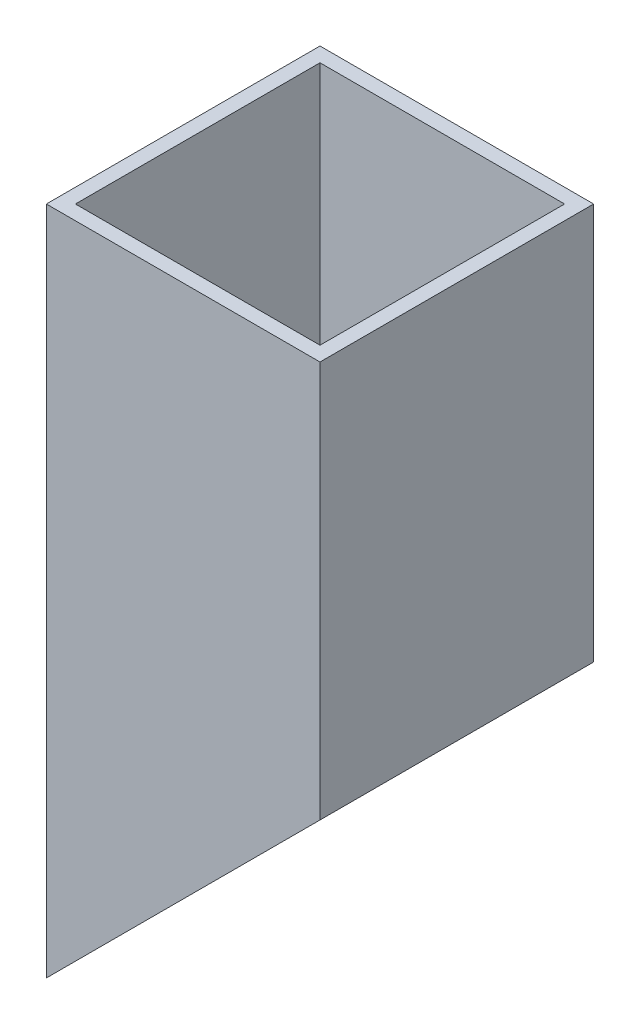
from build123d import *

# Parameters (mm, degrees)
CROQUIS1_W              = 56.5
CROQUIS1_H              = 56.5
SALIENTE_EXTRUIR1_DEPTH = 81.9
SALIENTE_EXTRUIR2_DEPTH = 56.5
VACIADO4_T              = -3


with BuildPart() as part:
    # Croquis1 → Saliente-Extruir1 (new body)
    with BuildSketch(Plane(origin=(0, 0, 0), x_dir=(1, 0, 0), z_dir=(0, 1, 0))):
        with Locations((28.25, 28.25)):
            Rectangle(CROQUIS1_W, CROQUIS1_H)
    extrude(amount=SALIENTE_EXTRUIR1_DEPTH)

    # Croquis2 → Saliente-Extruir2 (add)
    with BuildSketch(Plane.XY):
        Polygon((0, 0), (0, -56.5), (56.5, 0), align=None)
    extrude(amount=-SALIENTE_EXTRUIR2_DEPTH)

    # Vaciado4
    vaciado4_openings = [part.faces().sort_by_distance(p)[0] for p in [
        (28.25, 81.9, -28.25),
        (28.25, -28.25, -28.25),
    ]]
    offset(amount=VACIADO4_T, openings=vaciado4_openings, kind=Kind.INTERSECTION)


solid = part.part
